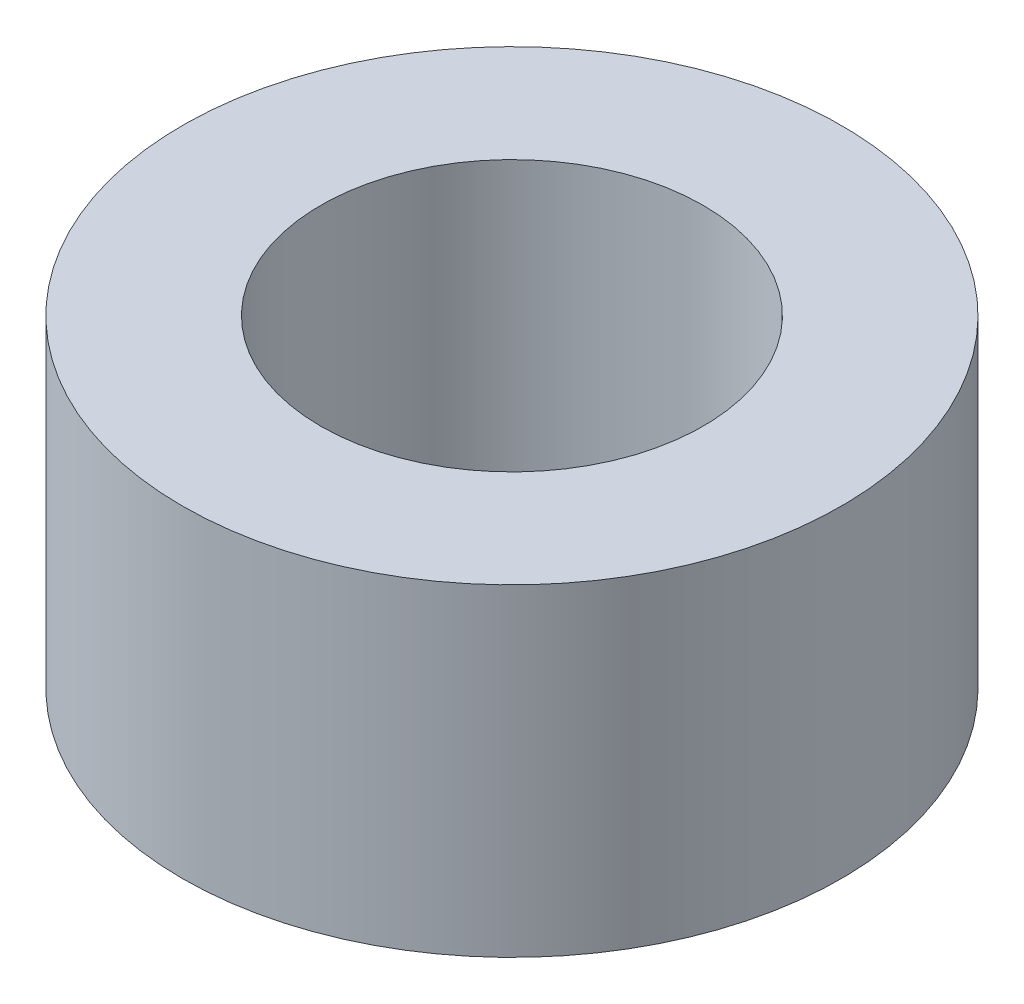
from build123d import *

# Parameters (mm, degrees)
SKETCH1_R           = 7.15
SKETCH1_R_2         = 4.15
BOSS_EXTRUDE1_DEPTH = 7


with BuildPart() as part:
    # Sketch1 → Boss-Extrude1 (new body)
    with BuildSketch(Plane(origin=(0, 0, 0), x_dir=(1, 0, 0), z_dir=(0, 1, 0))):
        with Locations(Location((0, 0, 0), (0, 0, 270))):
            Circle(SKETCH1_R)
        with Locations(Location((0, 0, 0), (0, 0, 270))):
            Circle(SKETCH1_R_2, mode=Mode.SUBTRACT)
    extrude(amount=BOSS_EXTRUDE1_DEPTH)


solid = part.part
